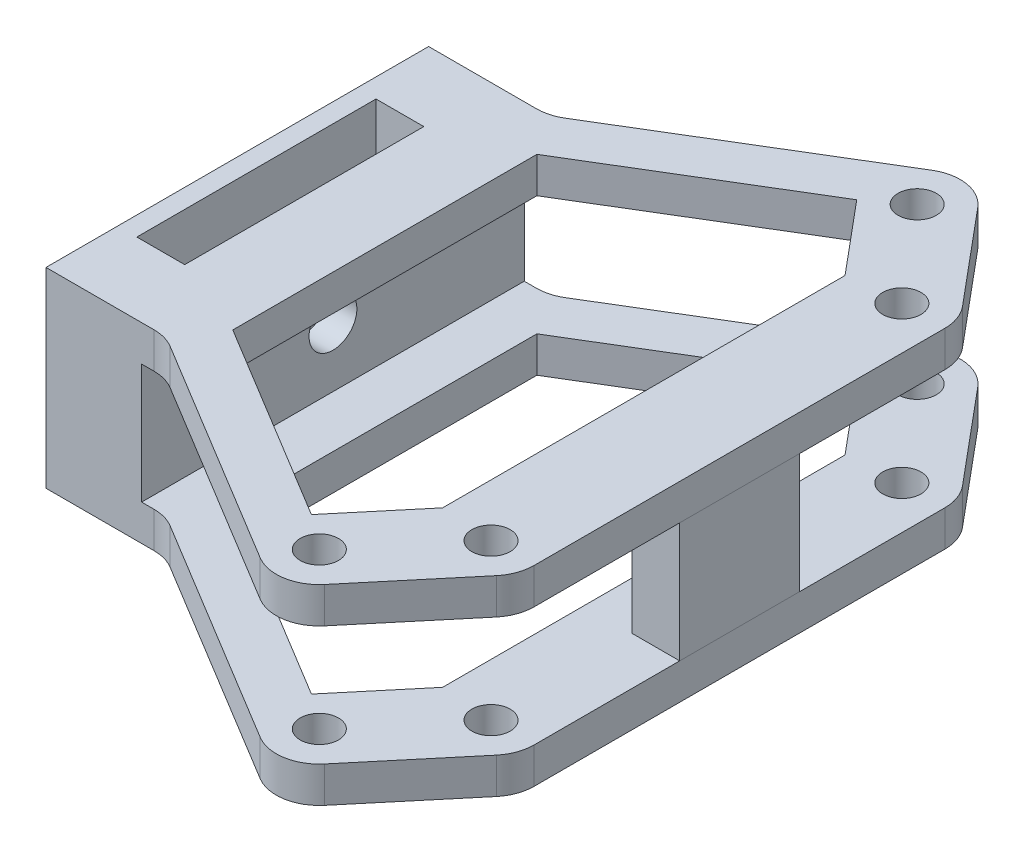
from build123d import *

# Parameters (mm, degrees)
BOSS_EXTRUDE1_DEPTH      = 20
BOSS_EXTRUDE1_DEPTH_BACK = 20
SKETCH2_R                = 4
SKETCH2_W                = 10
SKETCH2_H                = 50
CUT_EXTRUDE1_DEPTH       = 129.597239473
CUT_EXTRUDE1_DEPTH_BACK  = 129.597239473
SKETCH3_W                = 85
SKETCH3_H                = 25
SKETCH4_W                = 25
SKETCH4_H                = 25
BOSS_EXTRUDE2_DEPTH      = 10


with BuildPart() as part:
    # Sketch2 → Boss-Extrude1 (new, two sides: drawn at the far end of the back side and taken through both)
    with BuildSketch(Plane(origin=(0, 0, 0), x_dir=(1, 0, 0), z_dir=(0, 1, 0)).offset(-BOSS_EXTRUDE1_DEPTH_BACK)):
        with BuildLine():
            Line((0, -42.95), (0, 42.95))
            ThreePointArc((0, 42.95), (-0.540252712, 46.02126616), (-2.096150183, 48.723807903))
            Line((-2.096150183, 48.723807903), (-18.446150183, 68.273807903))
            ThreePointArc((-18.446150183, 68.273807903), (-23.87154407, 71.377734399), (-30.010051253, 70.199605335))
            Line((-30.010051253, 70.199605335), (-77.758993185, 41.300394665))
            ThreePointArc((-77.758993185, 41.300394665), (-80, 40.331192469), (-82.419044438, 40))
            Line((-82.419044438, 40), (-105, 40))
            Line((-105, 40), (-105, -40))
            Line((-105, -40), (-82.419044438, -40))
            ThreePointArc((-82.419044438, -40), (-80, -40.331192469), (-77.758993185, -41.300394665))
            Line((-77.758993185, -41.300394665), (-30.010051253, -70.199605335))
            ThreePointArc((-30.010051253, -70.199605335), (-23.87154407, -71.377734399), (-18.446150183, -68.273807903))
            Line((-18.446150183, -68.273807903), (-2.096150183, -48.723807903))
            ThreePointArc((-2.096150183, -48.723807903), (-0.540252712, -46.02126616), (0, -42.95))
        make_face()
        with Locations((-25.35, 62.5)):
            Circle(SKETCH2_R, mode=Mode.SUBTRACT)
        with Locations((-9, 42.95)):
            Circle(SKETCH2_R, mode=Mode.SUBTRACT)
        with Locations((-9, -42.95)):
            Circle(SKETCH2_R, mode=Mode.SUBTRACT)
        with Locations((-25.35, -62.5)):
            Circle(SKETCH2_R, mode=Mode.SUBTRACT)
        Polygon((-74.15, -31.795763765), (-74.15, 31.795763765), (-32.490659495, 57.009349846), (-20, 42.074035282), (-20, -42.074035282), (-32.490659495, -57.009349846), align=None, mode=Mode.SUBTRACT)
        with Locations((-96, 0)):
            Rectangle(SKETCH2_W, SKETCH2_H, mode=Mode.SUBTRACT)
    extrude(amount=BOSS_EXTRUDE1_DEPTH + BOSS_EXTRUDE1_DEPTH_BACK)

    # Sketch3 → Cut-Extrude1 (cut, two sides: drawn at the far end of the back side and taken through both)
    with BuildSketch(Plane.XY.offset(-CUT_EXTRUDE1_DEPTH_BACK)):
        with Locations((-42.5, 0)):
            Rectangle(SKETCH3_W, SKETCH3_H)
    extrude(amount=CUT_EXTRUDE1_DEPTH + CUT_EXTRUDE1_DEPTH_BACK, mode=Mode.SUBTRACT)

    # Sketch6 → Hole1 (revolve, cut)
    with BuildSketch(Plane(origin=(-105, 0, 0), x_dir=(0, 0, 1), z_dir=(0, 1, 0))):
        Polygon((0, 0), (0, 30), (5, 30), (5, 3), (12, 3), (12, 0), align=None)
    revolve(axis=Axis((5, 0, 0), (-1, 0, 0)), mode=Mode.SUBTRACT)


with BuildPart() as body_2:
    # Sketch4 → Boss-Extrude2 (new body)
    with BuildSketch(Plane(origin=(0, 0, 0), x_dir=(0, 0, -1), z_dir=(1, 0, 0))):
        Rectangle(SKETCH4_W, SKETCH4_H)
    extrude(amount=-BOSS_EXTRUDE2_DEPTH)


solid = Compound([part.part, body_2.part])
